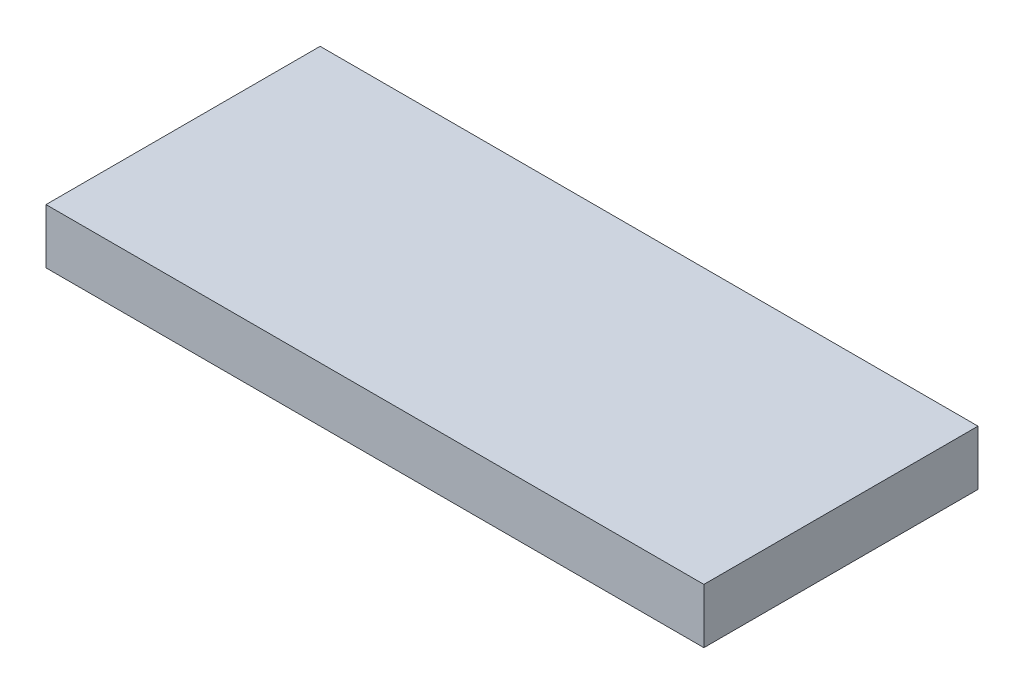
from build123d import *

# Parameters (mm, degrees)
SKETCH1_W           = 1200
SKETCH1_H           = 500
BOSS_EXTRUDE1_DEPTH = 100


with BuildPart() as part:
    # Sketch1 → Boss-Extrude1 (new body)
    with BuildSketch(Plane(origin=(0, 0, 0), x_dir=(1, 0, 0), z_dir=(0, 1, 0))):
        with Locations((224.242561038, 54.757641794)):
            Rectangle(SKETCH1_W, SKETCH1_H)
    extrude(amount=BOSS_EXTRUDE1_DEPTH)


solid = part.part
